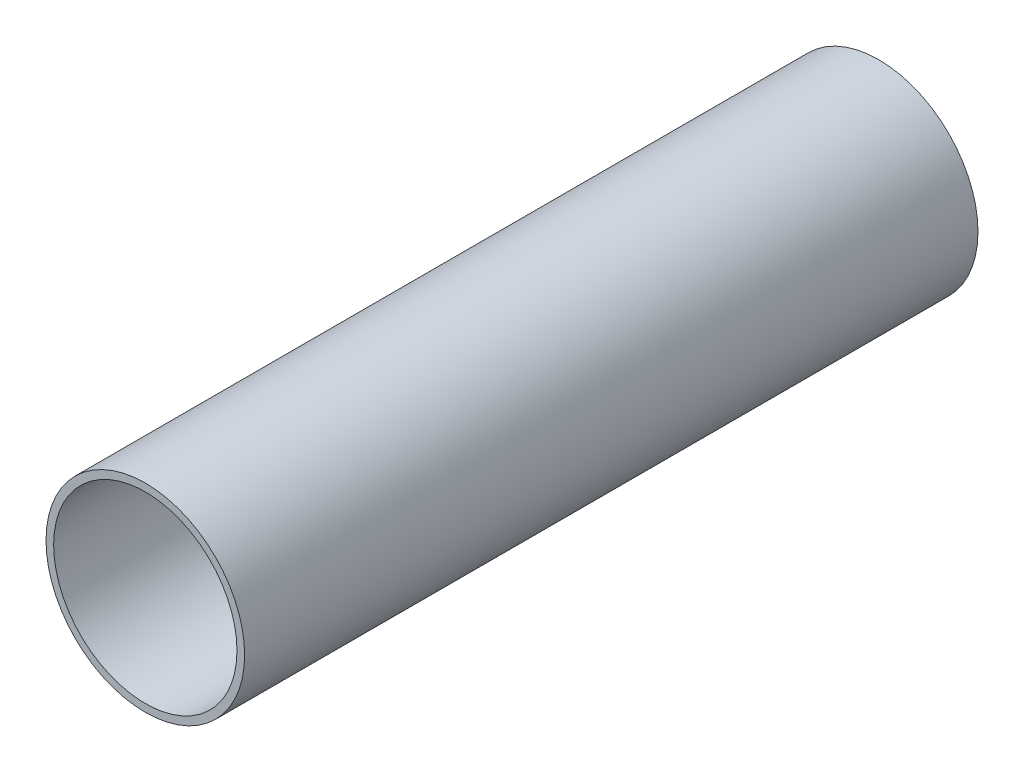
from build123d import *

# Parameters (mm, degrees)
SKETCH1_R           = 41.275
SKETCH1_R_2         = 38.1
BOSS_EXTRUDE1_DEPTH = 304.8


with BuildPart() as part:
    # Sketch1 → Boss-Extrude1 (new body)
    with BuildSketch(Plane.XY):
        with Locations(Location((0, 0, 0), (0, 0, 180))):
            Circle(SKETCH1_R)
        with Locations(Location((0, 0, 0), (0, 0, 180))):
            Circle(SKETCH1_R_2, mode=Mode.SUBTRACT)
    extrude(amount=BOSS_EXTRUDE1_DEPTH)


solid = part.part
